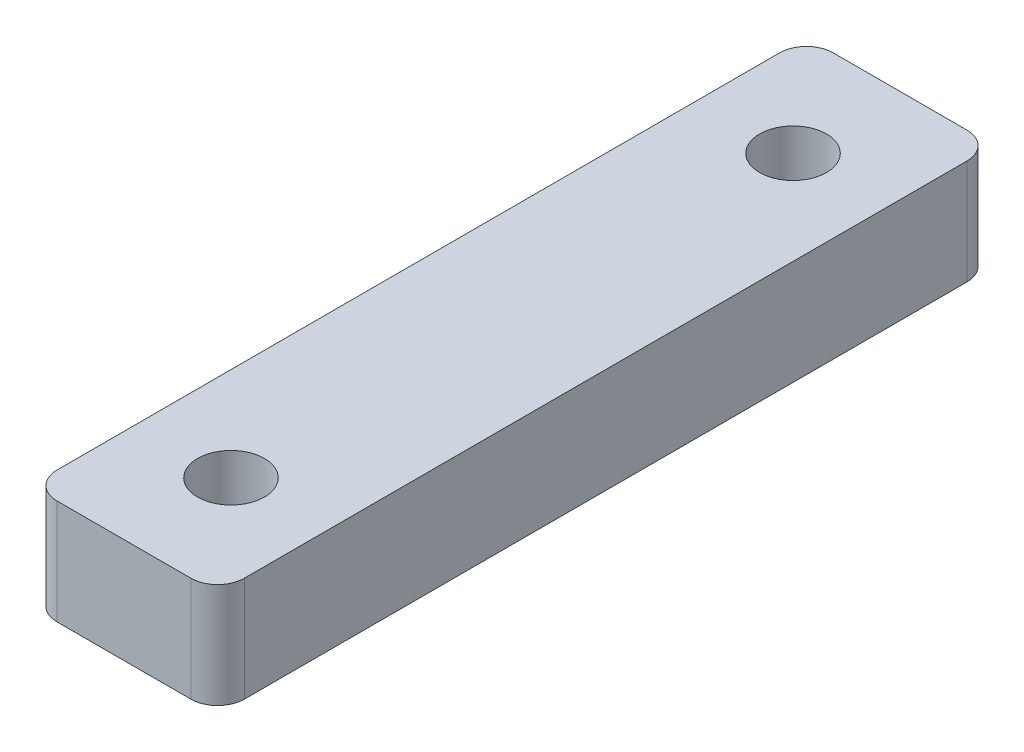
from build123d import *

# Parameters (mm, degrees)
SKETCH1_W           = 14
SKETCH1_H           = 58
SKETCH1_R           = 2.5
BOSS_EXTRUDE1_DEPTH = 7.83
FILLET1_R           = 2


with BuildPart() as part:
    # Sketch1 → Boss-Extrude1 (new body)
    with BuildSketch(Plane(origin=(0, 0, 0), x_dir=(1, 0, 0), z_dir=(0, 1, 0))):
        with Locations((7, 29)):
            Rectangle(SKETCH1_W, SKETCH1_H)
        with Locations(Location((7, 50, 0), (0, 0, 270))):
            Circle(SKETCH1_R, mode=Mode.SUBTRACT)
        with Locations(Location((7, 8, 0), (0, 0, 270))):
            Circle(SKETCH1_R, mode=Mode.SUBTRACT)
    extrude(amount=BOSS_EXTRUDE1_DEPTH)

    # Fillet1
    fillet1_edges = [part.edges().sort_by_distance(p)[0] for p in [
        (0, 3.915, 0),
        (0, 3.915, -58),
        (14, 3.915, -58),
        (14, 3.915, 0),
    ]]
    fillet(fillet1_edges, radius=FILLET1_R)


solid = part.part
